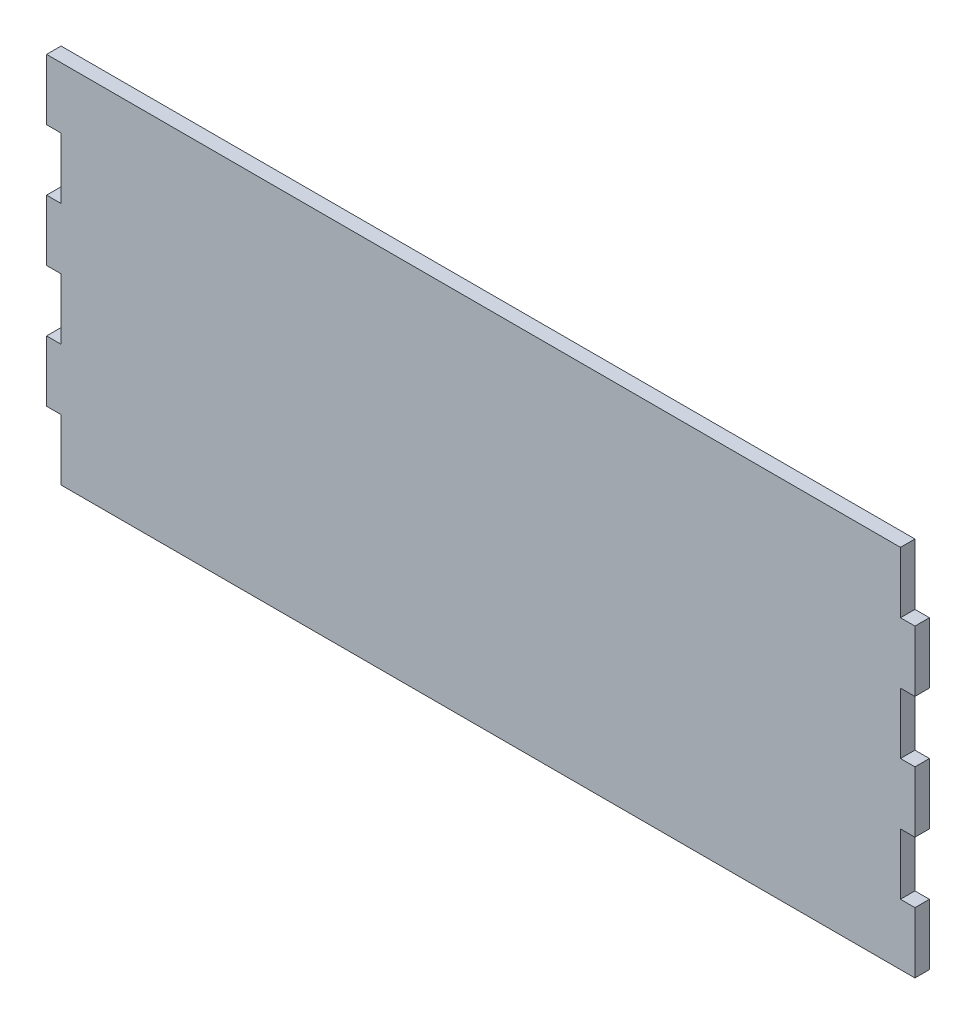
from build123d import *

# Parameters (mm, degrees)
ESBO_O1_W                = 174
ESBO_O1_H                = 75.81
RESSALTO_EXTRUS_O1_DEPTH = 3
ESBO_O3_W                = 3
ESBO_O3_H                = 12.635
RESSALTO_EXTRUS_O2_DEPTH = 3
ESBO_O4_W                = 3
ESBO_O4_H                = 12.635
RESSALTO_EXTRUS_O3_DEPTH = 3


with BuildPart() as part:
    # Esboço1 → Ressalto-extrusão1 (new body)
    with BuildSketch(Plane.XY):
        Rectangle(ESBO_O1_W, ESBO_O1_H)
    extrude(amount=RESSALTO_EXTRUS_O1_DEPTH)

    # Esboço3 → Ressalto-extrusão2 (add)
    with BuildSketch(Plane.XY.offset(3)):
        with Locations((-88.5, 6.3175)):
            Rectangle(ESBO_O3_W, ESBO_O3_H)
        with Locations((-88.5, 31.5875)):
            Rectangle(ESBO_O3_W, ESBO_O3_H)
        with Locations((-88.5, -18.9525)):
            Rectangle(ESBO_O3_W, ESBO_O3_H)
    extrude(amount=-RESSALTO_EXTRUS_O2_DEPTH)

    # Esboço4 → Ressalto-extrusão3 (add)
    with BuildSketch(Plane.XY.offset(3)):
        with Locations((88.5, 18.9525)):
            Rectangle(ESBO_O4_W, ESBO_O4_H)
        with Locations((88.5, -6.3175)):
            Rectangle(ESBO_O4_W, ESBO_O4_H)
        with Locations((88.5, -31.5875)):
            Rectangle(ESBO_O4_W, ESBO_O4_H)
    extrude(amount=-RESSALTO_EXTRUS_O3_DEPTH)


solid = part.part
